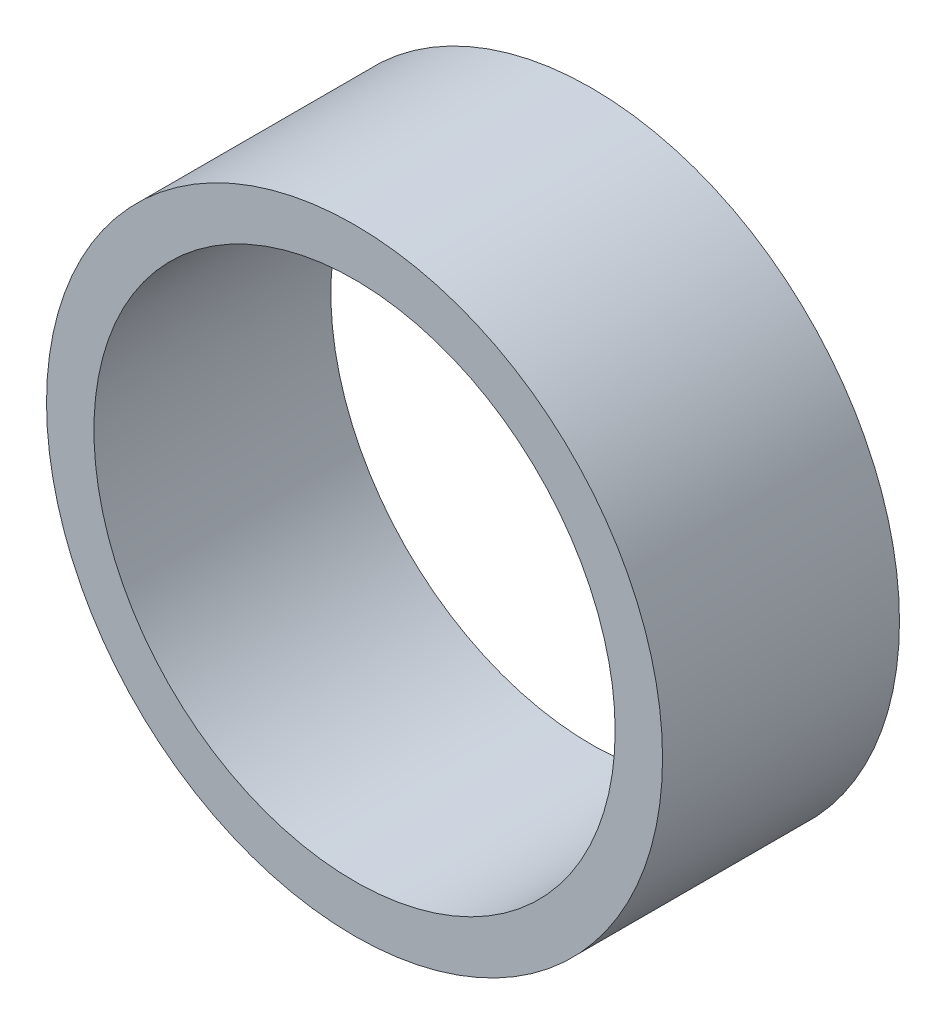
from build123d import *

# Parameters (mm, degrees)
SKETCH1_R           = 3.302
SKETCH1_R_2         = 2.794
BOSS_EXTRUDE1_DEPTH = 2.54


with BuildPart() as part:
    # Sketch1 → Boss-Extrude1 (new body)
    with BuildSketch(Plane.XY):
        Circle(SKETCH1_R)
        Circle(SKETCH1_R_2, mode=Mode.SUBTRACT)
    extrude(amount=BOSS_EXTRUDE1_DEPTH)


solid = part.part
